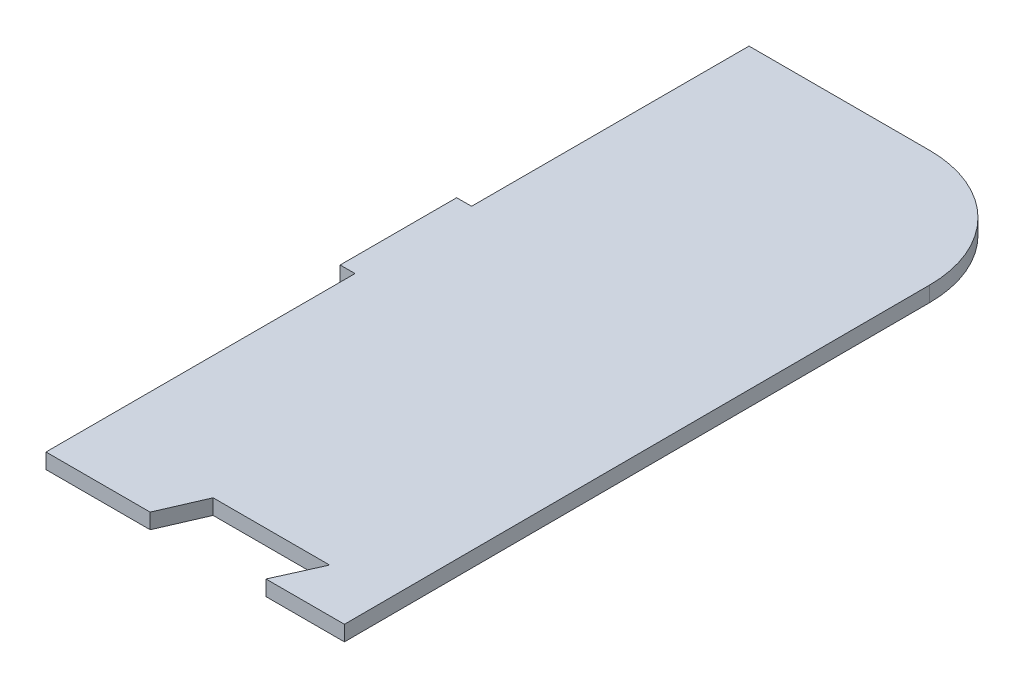
from build123d import *

# Parameters (mm, degrees)
BOSS_EXTRUDE1_DEPTH = 459.74
SKETCH3_W           = 117.668752198
SKETCH3_H           = 459.74
CUT_EXTRUDE1_DEPTH  = 10
SKETCH4_W           = 9.725175386
SKETCH4_H           = 202.0799409
SKETCH4_H_2         = 181.4600591
CUT_EXTRUDE3_DEPTH  = 63


with BuildPart() as part:
    # Sketch1 → Boss-Extrude1 (new body)
    with BuildSketch(Plane.XY):
        Polygon((358.121789204, 754.380000017), (137.961261276, 754.380000017), (137.961261276, 744.380000017), (562.803601281, 744.380000017), (562.803601281, 754.380000017), align=None)
    extrude(amount=BOSS_EXTRUDE1_DEPTH)

    # Sketch3 → Cut-Extrude1 (cut)
    with BuildSketch(Plane.XZ.offset(-744.380000017)):
        with Locations((196.795637375, 229.87)):
            Rectangle(SKETCH3_W, SKETCH3_H)
    extrude(amount=-CUT_EXTRUDE1_DEPTH, mode=Mode.SUBTRACT)

    # Sketch4 → Cut-Extrude3 (cut)
    with BuildSketch(Plane(origin=(0, 754.380000017, 0), x_dir=(1, 0, 0), z_dir=(0, 1, 0))):
        with Locations((260.492601167, -358.70002955)):
            Rectangle(SKETCH4_W, SKETCH4_H)
        with Locations((260.492601167, -90.73002955)):
            Rectangle(SKETCH4_W, SKETCH4_H_2)
        with BuildLine():
            Line((333.464234552, -459.74), (369.761877542, -561.839328351))
            Line((369.761877542, -561.839328351), (604.247212907, -525.668487146))
            Line((604.247212907, -525.668487146), (681.481358703, 161.10923172))
            Line((681.481358703, 161.10923172), (358.740146189, 101.846462791))
            Line((358.740146189, 101.846462791), (383.521789204, 0))
            ThreePointArc((383.521789204, 0), (437.403325931, -22.318463274), (459.721789204, -76.2))
            Line((459.721789204, -76.2), (460.501916297, -459.74))
            Line((460.501916297, -459.74), (409.216807378, -459.74))
            Line((409.216807378, -459.74), (422.130527537, -431.0400591))
            Line((422.130527537, -431.0400591), (345.930527537, -431.0400591))
            Line((345.930527537, -431.0400591), (333.464234552, -459.74))
        make_face()
    extrude(amount=-CUT_EXTRUDE3_DEPTH, mode=Mode.SUBTRACT)


solid = part.part
